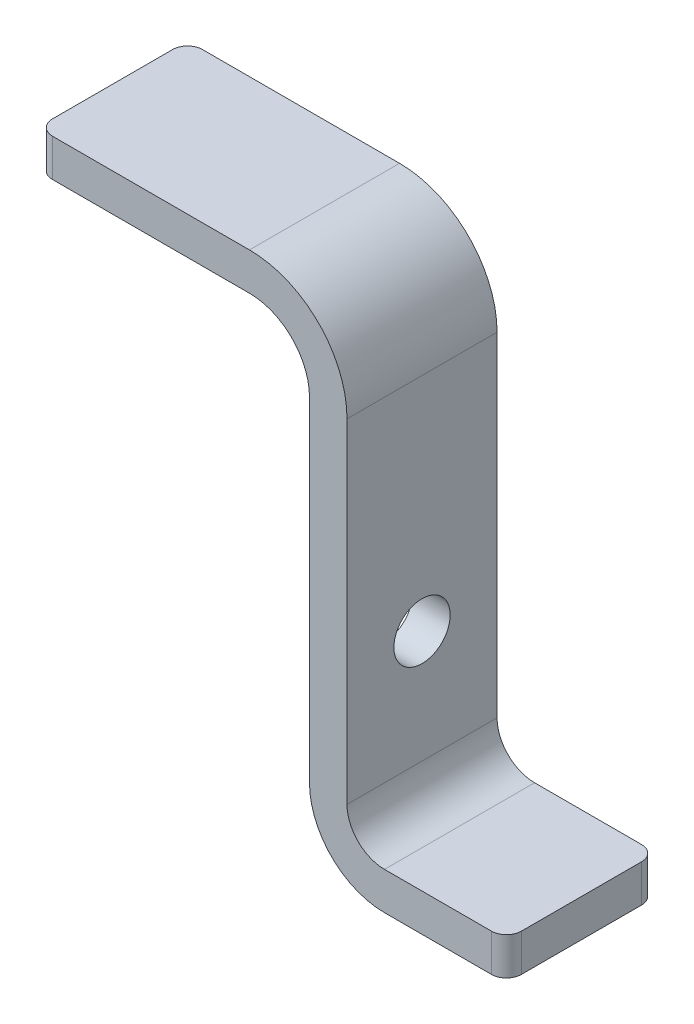
from build123d import *

# Parameters (mm, degrees)
BOSS_EXTRUDE1_DEPTH = 25.4
FILLET1_R           = 2.54
SKETCH2_R           = 4.7625
CUT_EXTRUDE1_DEPTH  = 75.818479696


with BuildPart() as part:
    # Sketch1 → Boss-Extrude1 (new body)
    with BuildSketch(Plane.XY):
        with BuildLine():
            Line((0, 32.383567293), (35.8775, 32.383567293))
            ThreePointArc((35.8775, 32.383567293), (43.061704897, 29.40777219), (46.0375, 22.223567293))
            Line((46.0375, 22.223567293), (46.0375, -34.291432707))
            ThreePointArc((46.0375, -34.291432707), (49.757243879, -43.271688828), (58.7375, -46.991432707))
            Line((58.7375, -46.991432707), (79.375, -46.991432707))
            Line((79.375, -46.991432707), (79.375, -40.641432707))
            Line((79.375, -40.641432707), (58.7375, -40.641432707))
            ThreePointArc((58.7375, -40.641432707), (54.247371939, -38.781560767), (52.3875, -34.291432707))
            Line((52.3875, -34.291432707), (52.3875, 22.223567293))
            ThreePointArc((52.3875, 22.223567293), (47.551832957, 33.897900251), (35.8775, 38.733567293))
            Line((35.8775, 38.733567293), (0, 38.733567293))
            Line((0, 38.733567293), (0, 32.383567293))
        make_face()
    extrude(amount=-BOSS_EXTRUDE1_DEPTH)

    # Fillet1
    fillet1_edges = [part.edges().sort_by_distance(p)[0] for p in [
        (79.375, -43.816432707, 0),
        (0, 35.558567293, 0),
        (79.375, -43.816432707, -25.4),
        (0, 35.558567293, -25.4),
    ]]
    fillet(fillet1_edges, radius=FILLET1_R)

    # Sketch2 → Cut-Extrude1 (cut, through all)
    with BuildSketch(Plane(origin=(52.3875, 0, 0), x_dir=(0, 0, -1), z_dir=(1, 0, 0))):
        with Locations(Location((12.7, -15.241432707, 0), (0, 0, 90))):
            Circle(SKETCH2_R)
    extrude(amount=-CUT_EXTRUDE1_DEPTH, mode=Mode.SUBTRACT)


solid = part.part
